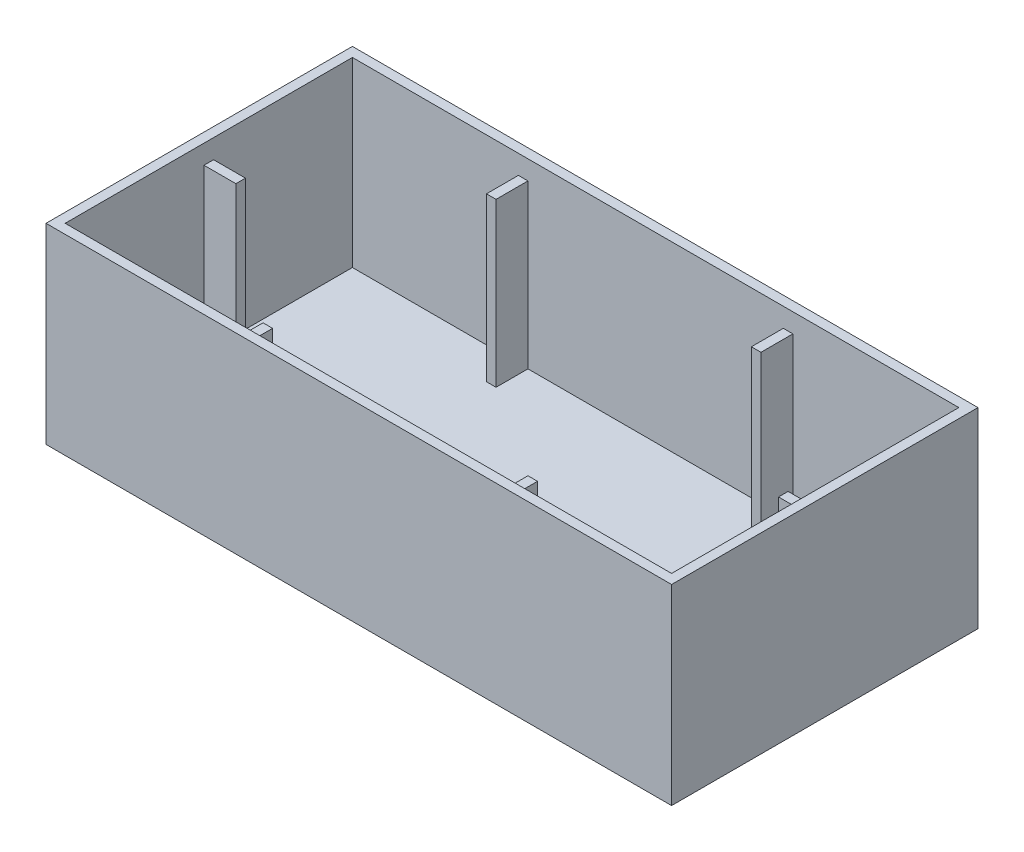
from build123d import *

# Parameters (mm, degrees)
SKETCH1_W           = 98
SKETCH1_H           = 48
BOSS_EXTRUDE1_DEPTH = 30
SHELL1_T            = -1.5
SKETCH2_W           = 1.5
SKETCH2_H           = 5
SKETCH2_W_2         = 5
SKETCH2_H_2         = 1.5
BOSS_EXTRUDE2_DEPTH = 25.5


with BuildPart() as part:
    # Sketch1 → Boss-Extrude1 (new body)
    with BuildSketch(Plane(origin=(0, 0, 0), x_dir=(1, 0, 0), z_dir=(0, 1, 0))):
        Rectangle(SKETCH1_W, SKETCH1_H)
    extrude(amount=BOSS_EXTRUDE1_DEPTH)

    # Shell1
    shell1_openings = [part.faces().sort_by_distance(p)[0] for p in [
        (0, 30, 0),
    ]]
    offset(amount=SHELL1_T, openings=shell1_openings, kind=Kind.INTERSECTION)

    # Sketch2 → Boss-Extrude2 (add)
    with BuildSketch(Plane(origin=(0, 1.5, 0), x_dir=(1, 0, 0), z_dir=(0, 1, 0))):
        with Locations((-20.75, 20)):
            Rectangle(SKETCH2_W, SKETCH2_H)
        with Locations((20.75, 20)):
            Rectangle(SKETCH2_W, SKETCH2_H)
        with Locations((20.75, -20)):
            Rectangle(SKETCH2_W, SKETCH2_H)
        with Locations((-20.75, -20)):
            Rectangle(SKETCH2_W, SKETCH2_H)
        with Locations((45, 0)):
            Rectangle(SKETCH2_W_2, SKETCH2_H_2)
        with Locations((-45, 0)):
            Rectangle(SKETCH2_W_2, SKETCH2_H_2)
    extrude(amount=BOSS_EXTRUDE2_DEPTH)


solid = part.part
